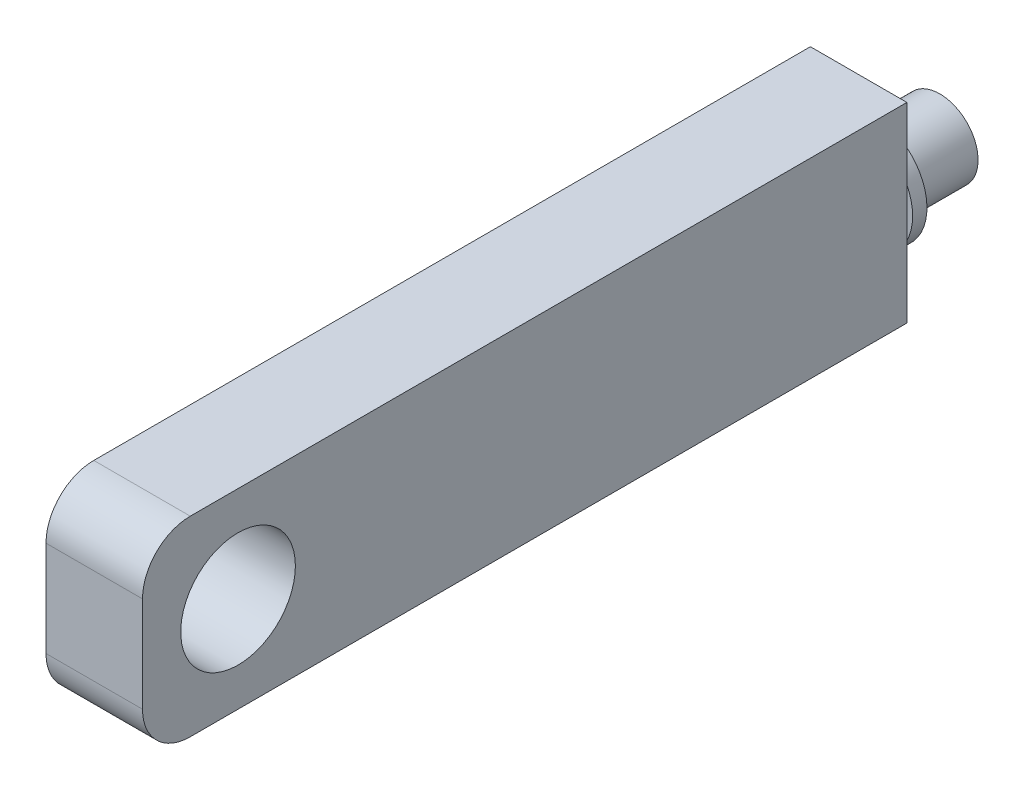
from build123d import *

# Parameters (mm, degrees)
SKETCH1_W           = 10.1
SKETCH1_H           = 80
BOSS_EXTRUDE1_DEPTH = 20
CUT_EXTRUDE1_REACH  = 85.078
SKETCH2_R           = 6
FILLET1_R           = 5
SKETCH3_R           = 4
BOSS_EXTRUDE2_DEPTH = 8.5
SKETCH4_R           = 5.65
BOSS_EXTRUDE3_DEPTH = 1.5


with BuildPart() as part:
    # Sketch1 → Boss-Extrude1 (new body)
    with BuildSketch(Plane(origin=(0, 0, 0), x_dir=(1, 0, 0), z_dir=(0, 1, 0))):
        with Locations((5.05, 40)):
            Rectangle(SKETCH1_W, SKETCH1_H)
    extrude(amount=BOSS_EXTRUDE1_DEPTH)

    # Sketch2 → Cut-Extrude1 (cut, up to next)
    with BuildSketch(Plane(origin=(10.1, 0, 0), x_dir=(0, 0, -1), z_dir=(1, 0, 0)), mode=Mode.PRIVATE) as cut_extrude1_sk1:
        with Locations((10, 10)):
            Circle(SKETCH2_R)
    cut_extrude1_tool1 = extrude(cut_extrude1_sk1.sketch, amount=-CUT_EXTRUDE1_REACH, mode=Mode.PRIVATE) & part.part
    add(cut_extrude1_tool1.solids().sort_by_distance((10.1, 10, -10))[0], mode=Mode.SUBTRACT)

    # Fillet1
    fillet1_edges = [part.edges().sort_by_distance(p)[0] for p in [
        (5.05, 0, 0),
        (5.05, 20, 0),
    ]]
    fillet(fillet1_edges, radius=FILLET1_R)

    # Sketch3 → Boss-Extrude2 (add)
    with BuildSketch(Plane(origin=(0, 0, -80), x_dir=(-1, 0, 0), z_dir=(0, 0, -1))):
        with Locations(Location((-5.05, 10, 0), (0, 0, 180))):
            Circle(SKETCH3_R)
    extrude(amount=BOSS_EXTRUDE2_DEPTH)

    # Sketch4 → Boss-Extrude3 (add)
    with BuildSketch(Plane(origin=(0, 0, -80), x_dir=(-1, 0, 0), z_dir=(0, 0, -1))):
        with Locations(Location((-5.05, 10, 0), (0, 0, 206.64461444))):
            Circle(SKETCH4_R)
    extrude(amount=BOSS_EXTRUDE3_DEPTH)


solid = part.part
